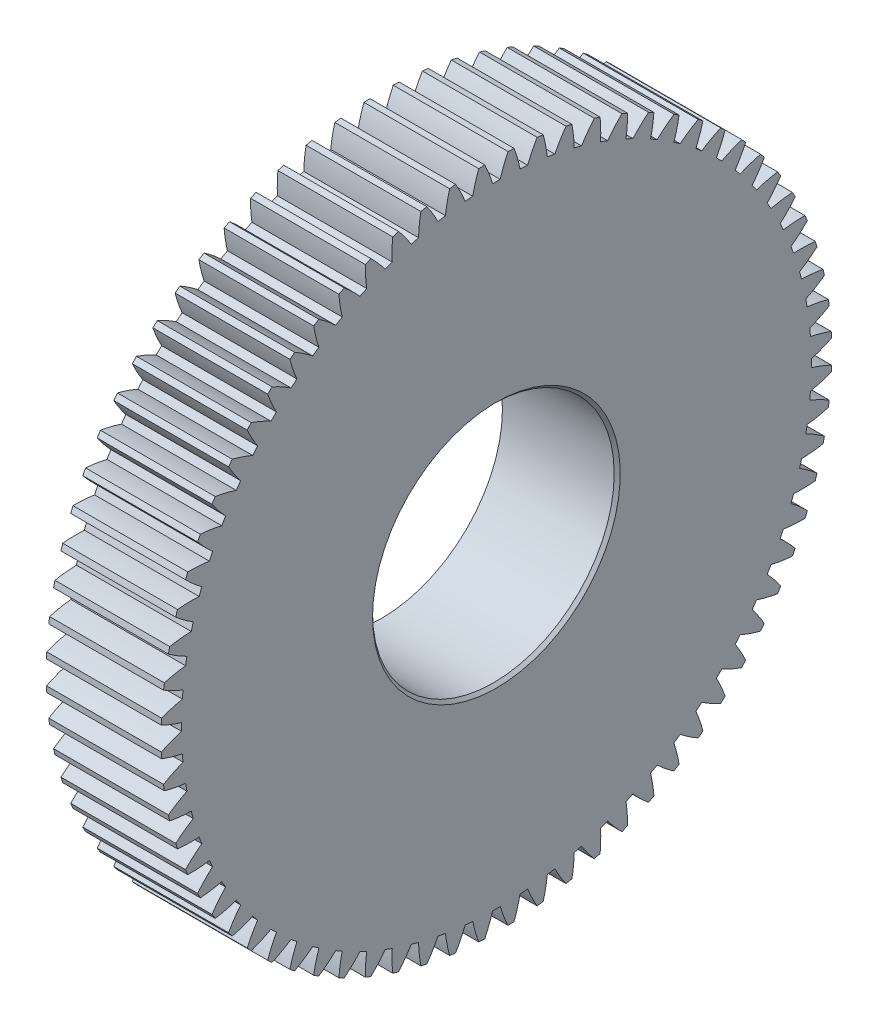
from build123d import *

# Parameters (mm, degrees)
BASPROSKE_W     = 38
BASPROSKE_H     = 111
TOOTHCUT_DEPTH  = 162.51160949
TEETHCUTS_COUNT = 72
BORSKE_R        = 40
BORE_DEPTH      = 50.0000508
SMUSSO1_SIZE    = 1


with BuildPart() as part:
    # BasProSke → Base-Revolve (revolve)
    with BuildSketch(Plane(origin=(0, 0, 0), x_dir=(1, 0, 0), z_dir=(0, 1, 0)), mode=Mode.PRIVATE) as base_revolve_sk:
        with Locations((19, 55.5)):
            Rectangle(BASPROSKE_W, BASPROSKE_H)
    revolve(base_revolve_sk.sketch.rotate(Axis((-10, 0, 0), (1, 0, 0)), 180), axis=Axis((-10, 0, 0), (1, 0, 0)))

    # TooCutSke → ToothCut (cut, through all)
    with BuildSketch(Plane(origin=(0, 0, 0), x_dir=(0, 0, -1), z_dir=(1, 0, 0))):
        with BuildLine():
            ThreePointArc((1.260102081, 104.241384026), (0, 104.249), (-1.260102081, 104.241384026))
            ThreePointArc((-1.260102081, 104.241384026), (-2.419555529, 107.654106549), (-3.859459153, 110.958298564))
            ThreePointArc((-3.859459153, 110.958298564), (0, 111.0254), (3.859459153, 110.958298564))
            ThreePointArc((3.859459153, 110.958298564), (2.419555529, 107.654106549), (1.260102081, 104.241384026))
        make_face()
    toothcut = extrude(amount=TOOTHCUT_DEPTH, mode=Mode.SUBTRACT)

    # TeethCuts: ToothCut ×72 about axis
    teethcuts_axis = Axis((0, 0, 0), (1, 0, 0))
    for i in range(1, TEETHCUTS_COUNT):
        add(toothcut.rotate(teethcuts_axis, i * 360 / TEETHCUTS_COUNT), mode=Mode.SUBTRACT)

    # BorSke → Bore (cut, symmetric)
    with BuildSketch(Plane(origin=(0, 0, 0), x_dir=(0, 0, -1), z_dir=(1, 0, 0))):
        with Locations(Location((0, 0, 0), (0, 0, 180))):
            Circle(BORSKE_R)
    extrude(amount=BORE_DEPTH, both=True, mode=Mode.SUBTRACT)

    # Smusso1
    smusso1_edges = [part.edges().sort_by_distance(p)[0] for p in [
        (38, 0, -40),
    ]]
    chamfer(smusso1_edges, length=SMUSSO1_SIZE)


solid = part.part
